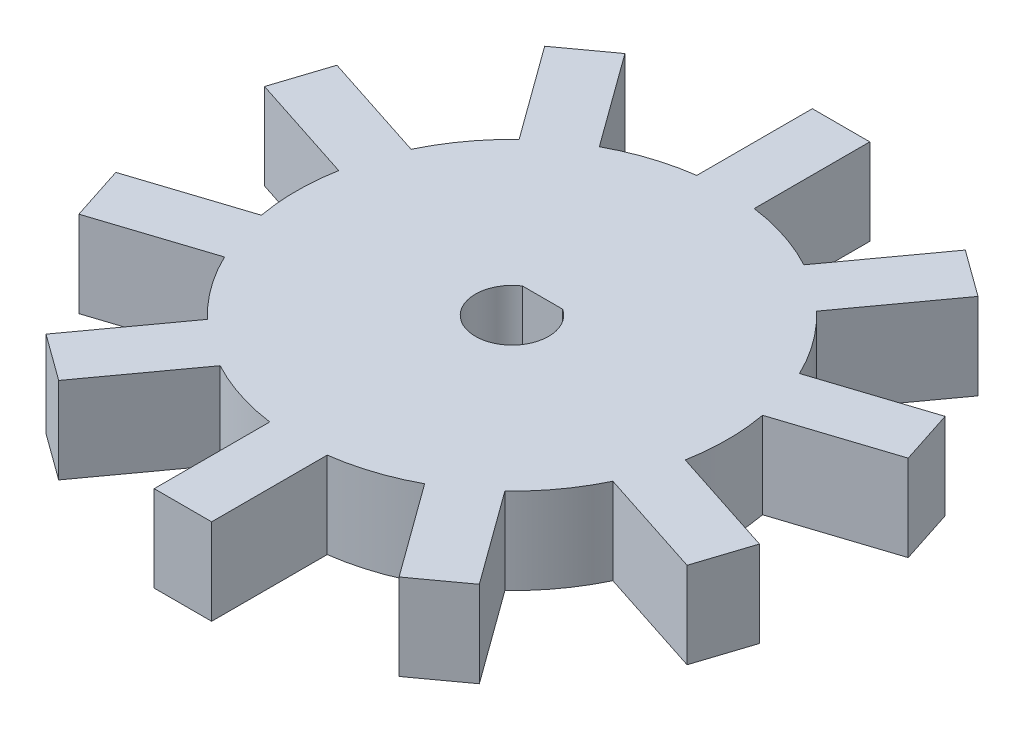
from build123d import *

# Parameters (mm, degrees)
SKETCH1_R           = 15
BOSS_EXTRUDE1_DEPTH = 6
CUT_EXTRUDE1_DEPTH  = 6


with BuildPart() as part:
    # Sketch1 → Boss-Extrude1 (new body)
    with BuildSketch(Plane(origin=(0, 0, 0), x_dir=(1, 0, 0), z_dir=(0, 1, 0))):
        with BuildLine():
            Line((-7.12002198, 13.202472761), (-11.849818066, 19.712478581))
            Line((-11.849818066, 19.712478581), (-15.085886044, 17.361337572))
            Line((-15.085886044, 17.361337572), (-10.356089958, 10.851331752))
            ThreePointArc((-10.356089958, 10.851331752), (-8.816778784, 12.135254916), (-7.12002198, 13.202472761))
        make_face()
        with BuildLine():
            Line((2, 22.912878475), (-2, 22.912878475))
            Line((-2, 22.912878475), (-2, 14.866068747))
            ThreePointArc((-2, 14.866068747), (0, 15), (2, 14.866068747))
            Line((2, 14.866068747), (2, 22.912878475))
        make_face()
        with BuildLine():
            Line((15.085886044, 17.361337572), (11.849818066, 19.712478581))
            Line((11.849818066, 19.712478581), (7.12002198, 13.202472761))
            ThreePointArc((7.12002198, 13.202472761), (8.816778784, 12.135254916), (10.356089958, 10.851331752))
            Line((10.356089958, 10.851331752), (15.085886044, 17.361337572))
        make_face()
        with BuildLine():
            Line((22.409476369, 5.178355806), (21.173408392, 8.982581871))
            Line((21.173408392, 8.982581871), (13.520437565, 6.495980915))
            ThreePointArc((13.520437565, 6.495980915), (14.265847744, 4.635254916), (14.756505543, 2.69175485))
            Line((14.756505543, 2.69175485), (22.409476369, 5.178355806))
        make_face()
        Circle(SKETCH1_R)
        with BuildLine():
            Line((21.173408392, -8.982581871), (22.409476369, -5.178355806))
            Line((22.409476369, -5.178355806), (14.756505543, -2.69175485))
            ThreePointArc((14.756505543, -2.69175485), (14.265847744, -4.635254916), (13.520437565, -6.495980915))
            Line((13.520437565, -6.495980915), (21.173408392, -8.982581871))
        make_face()
        with BuildLine():
            Line((11.849818066, -19.712478581), (15.085886044, -17.361337572))
            Line((15.085886044, -17.361337572), (10.356089958, -10.851331752))
            ThreePointArc((10.356089958, -10.851331752), (8.816778784, -12.135254916), (7.12002198, -13.202472761))
            Line((7.12002198, -13.202472761), (11.849818066, -19.712478581))
        make_face()
        with BuildLine():
            Line((-2, -14.866068747), (-2, -22.912878475))
            Line((-2, -22.912878475), (2, -22.912878475))
            Line((2, -22.912878475), (2, -14.866068747))
            ThreePointArc((2, -14.866068747), (0, -15), (-2, -14.866068747))
        make_face()
        with BuildLine():
            Line((-10.356089958, -10.851331752), (-15.085886044, -17.361337572))
            Line((-15.085886044, -17.361337572), (-11.849818066, -19.712478581))
            Line((-11.849818066, -19.712478581), (-7.12002198, -13.202472761))
            ThreePointArc((-7.12002198, -13.202472761), (-8.816778784, -12.135254916), (-10.356089958, -10.851331752))
        make_face()
        with BuildLine():
            Line((-14.756505543, -2.69175485), (-22.409476369, -5.178355806))
            Line((-22.409476369, -5.178355806), (-21.173408392, -8.982581871))
            Line((-21.173408392, -8.982581871), (-13.520437565, -6.495980915))
            ThreePointArc((-13.520437565, -6.495980915), (-14.265847744, -4.635254916), (-14.756505543, -2.69175485))
        make_face()
        with BuildLine():
            Line((-13.520437565, 6.495980915), (-21.173408392, 8.982581871))
            Line((-21.173408392, 8.982581871), (-22.409476369, 5.178355806))
            Line((-22.409476369, 5.178355806), (-14.756505543, 2.69175485))
            ThreePointArc((-14.756505543, 2.69175485), (-14.265847744, 4.635254916), (-13.520437565, 6.495980915))
        make_face()
    extrude(amount=BOSS_EXTRUDE1_DEPTH)

    # Sketch2 → Cut-Extrude1 (cut)
    with BuildSketch(Plane(origin=(0, 6, 0), x_dir=(1, 0, 0), z_dir=(0, 1, 0))):
        with BuildLine():
            Line((1.401998573, 2.13), (-1.401998573, 2.13))
            ThreePointArc((-1.401998573, 2.13), (-1.209835451, -2.24472675), (2.55, 0))
            ThreePointArc((2.55, 0), (2.24472675, 1.209835451), (1.401998573, 2.13))
        make_face()
    extrude(amount=-CUT_EXTRUDE1_DEPTH, mode=Mode.SUBTRACT)


solid = part.part
